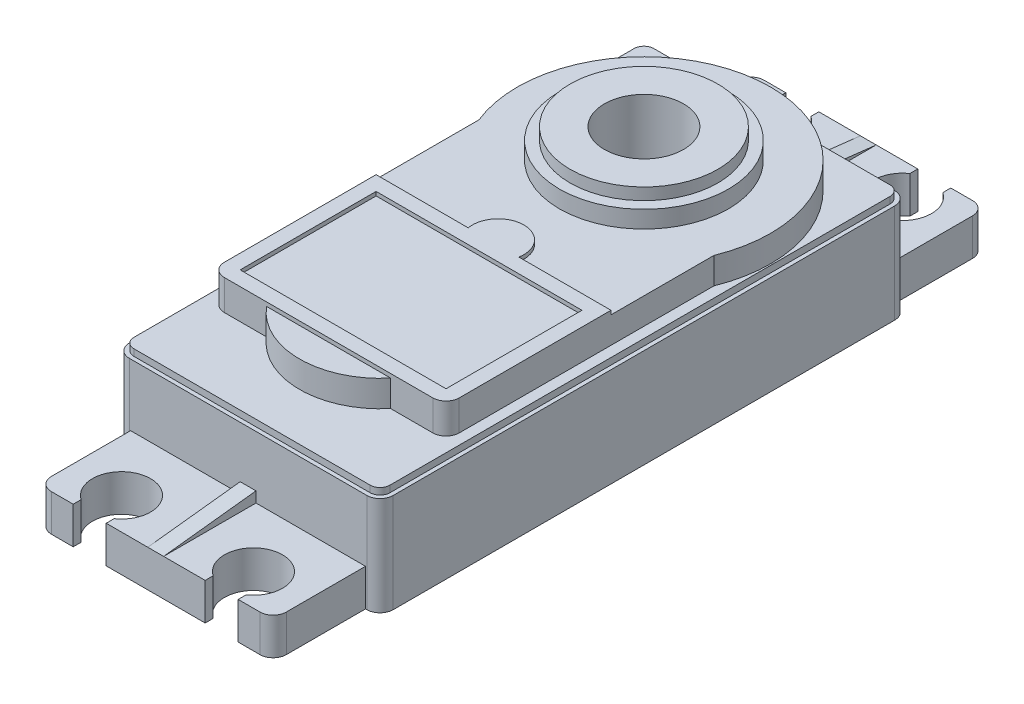
from build123d import *

# Parameters (mm, degrees)
SKETCH6_W            = 20
SKETCH6_H            = 40
BOSS_EXTRUDE3_DEPTH  = 8
CUT_EXTRUDE3_REACH   = 25.749
SKETCH11_R           = 3
SKETCH12_W           = 17.8
SKETCH12_H           = 2.8
BOSS_EXTRUDE4_DEPTH  = 7
CUT_EXTRUDE4_DEPTH   = 30.258161255
SKETCH20_R           = 0.7
CUT_EXTRUDE7_DEPTH   = 0.5
BOSS_EXTRUDE8_DEPTH  = 0.6
MIRROR7_COPY_1_DEPTH = 30.258161255
BOSS_EXTRUDE6_START  = 2
SKETCH16_R           = 3
BOSS_EXTRUDE6_DEPTH  = 2
BOSS_EXTRUDE9_DEPTH  = 2
BOSS_EXTRUDE10_START = 1.3
SKETCH24_R           = 6.4
SKETCH24_R_2         = 3
BOSS_EXTRUDE10_DEPTH = 1.3
BOSS_EXTRUDE11_START = 0.9
SKETCH25_R           = 5.6
SKETCH25_R_2         = 3
BOSS_EXTRUDE11_DEPTH = 0.9
SKETCH26_W           = 17.8
SKETCH26_H           = 12.5
SKETCH26_W_2         = 15.6
SKETCH26_H_2         = 10.3
BOSS_EXTRUDE12_DEPTH = 0.3
BOSS_EXTRUDE13_DEPTH = 0.3
SKETCH28_W           = 20
SKETCH28_H           = 40
SKETCH28_W_2         = 19.4
SKETCH28_H_2         = 39.4
CUT_EXTRUDE8_DEPTH   = 0.5
FILLET1_R            = 1
FILLET2_R            = 0.75


with BuildPart() as part:
    # Sketch6 → Boss-Extrude3 (new body)
    with BuildSketch(Plane(origin=(0, 0, 0), x_dir=(1, 0, 0), z_dir=(0, 1, 0))):
        Rectangle(SKETCH6_W, SKETCH6_H)
    extrude(amount=BOSS_EXTRUDE3_DEPTH)

    # Sketch11 → Cut-Extrude3 (cut, up to next)
    with BuildSketch(Plane(origin=(0, 8, 0), x_dir=(1, 0, 0), z_dir=(0, 1, 0)), mode=Mode.PRIVATE) as cut_extrude3_sk1:
        with Locations(Location((0, 10, 0), (0, 0, 270))):
            Circle(SKETCH11_R)
    cut_extrude3_tool1 = extrude(cut_extrude3_sk1.sketch, amount=-CUT_EXTRUDE3_REACH, mode=Mode.PRIVATE) & part.part
    add(cut_extrude3_tool1.solids().sort_by_distance((0, 8, -10))[0], mode=Mode.SUBTRACT)

    # Sketch12 → Boss-Extrude4 (add)
    with BuildSketch(Plane.XY.offset(20)):
        with Locations((0, 1.4)):
            Rectangle(SKETCH12_W, SKETCH12_H)
    boss_extrude4 = extrude(amount=BOSS_EXTRUDE4_DEPTH)

    # Sketch13 → Cut-Extrude4 (cut, through all)
    with BuildSketch(Plane(origin=(0, 2.8, 0), x_dir=(1, 0, 0), z_dir=(0, 1, 0))):
        with BuildLine():
            Line((-6.25, -26.4), (-6.25, -27))
            Line((-6.25, -27), (-3.75, -27))
            Line((-3.75, -27), (-3.75, -26.4))
            ThreePointArc((-3.75, -26.4), (-5, -22.389613301), (-6.25, -26.4))
        make_face()
    cut_extrude4 = extrude(amount=-CUT_EXTRUDE4_DEPTH, mode=Mode.SUBTRACT)

    # Mirror6: Cut-Extrude4 across plane
    add(cut_extrude4.mirror(Plane(origin=(0, 0, 0), x_dir=(0, 0, 1), z_dir=(1, 0, 0))), mode=Mode.SUBTRACT)

    # Sketch20 → Cut-Extrude7 (cut)
    with BuildSketch(Plane(origin=(0, 0, 0), x_dir=(-1, 0, 0), z_dir=(0, -1, 0))):
        with Locations(Location((0, -25, 0), (0, 0, 90))):
            Circle(SKETCH20_R)
    cut_extrude7 = extrude(amount=-CUT_EXTRUDE7_DEPTH, mode=Mode.SUBTRACT)

    # Sketch21 → Boss-Extrude8 (add, symmetric)
    with BuildSketch(Plane(origin=(0, 0, 0), x_dir=(0, 0, -1), z_dir=(1, 0, 0))):
        Polygon((-27, 2.8), (-20, 3.6), (-20, 2.8), align=None)
    boss_extrude8 = extrude(amount=BOSS_EXTRUDE8_DEPTH, both=True)

    # Mirror7: Boss-Extrude4, Cut-Extrude4, Cut-Extrude7, Boss-Extrude8 across plane
    add(boss_extrude4.mirror(Plane.XY))
    add(cut_extrude4.mirror(Plane.XY), mode=Mode.SUBTRACT)
    add(cut_extrude7.mirror(Plane.XY), mode=Mode.SUBTRACT)
    add(boss_extrude8.mirror(Plane.XY))

    # Mirror7 copy 1 sketch → Mirror7 copy 1 (cut, through all)
    with BuildSketch(Plane(origin=(0, 2.8, 0), x_dir=(-1, 0, 0), z_dir=(0, 1, 0))):
        with BuildLine():
            Line((-6.25, -26.4), (-6.25, -27))
            Line((-6.25, -27), (-3.75, -27))
            Line((-3.75, -27), (-3.75, -26.4))
            ThreePointArc((-3.75, -26.4), (-5, -22.389613301), (-6.25, -26.4))
        make_face()
    extrude(amount=-MIRROR7_COPY_1_DEPTH, mode=Mode.SUBTRACT)

    # Sketch16 → Boss-Extrude6 (add)
    with BuildSketch(Plane(origin=(0, 8, 0), x_dir=(1, 0, 0), z_dir=(0, 1, 0)).offset(BOSS_EXTRUDE6_START)):
        with BuildLine():
            Line((-8.9, -13.898610843), (8.9, -13.898610843))
            Line((8.9, -13.898610843), (8.9, 6.401389157))
            ThreePointArc((8.9, 6.401389157), (0, 19.6), (-8.9, 6.401389157))
            Line((-8.9, 6.401389157), (-8.9, -13.898610843))
        make_face()
        with Locations(Location((0, 10, 0), (0, 0, 270))):
            Circle(SKETCH16_R, mode=Mode.SUBTRACT)
    extrude(amount=-BOSS_EXTRUDE6_DEPTH)

    # Sketch23 → Boss-Extrude9 (add)
    with BuildSketch(Plane(origin=(0, 8, 0), x_dir=(1, 0, 0), z_dir=(0, 1, 0))):
        with BuildLine():
            Line((-4.7, -13.898610843), (4.7, -13.898610843))
            ThreePointArc((4.7, -13.898610843), (0, -16.098610843), (-4.7, -13.898610843))
        make_face()
    extrude(amount=BOSS_EXTRUDE9_DEPTH)

    # Sketch24 → Boss-Extrude10 (add)
    with BuildSketch(Plane(origin=(0, 10, 0), x_dir=(1, 0, 0), z_dir=(0, 1, 0)).offset(BOSS_EXTRUDE10_START)):
        with Locations(Location((0, 10, 0), (0, 0, 270))):
            Circle(SKETCH24_R)
        with Locations(Location((0, 10, 0), (0, 0, 270))):
            Circle(SKETCH24_R_2, mode=Mode.SUBTRACT)
    extrude(amount=-BOSS_EXTRUDE10_DEPTH)

    # Sketch25 → Boss-Extrude11 (add)
    with BuildSketch(Plane(origin=(0, 11.3, 0), x_dir=(1, 0, 0), z_dir=(0, 1, 0)).offset(BOSS_EXTRUDE11_START)):
        with Locations(Location((0, 10, 0), (0, 0, 270))):
            Circle(SKETCH25_R)
        with Locations(Location((0, 10, 0), (0, 0, 270))):
            Circle(SKETCH25_R_2, mode=Mode.SUBTRACT)
    extrude(amount=-BOSS_EXTRUDE11_DEPTH)

    # Sketch26 → Boss-Extrude12 (add)
    with BuildSketch(Plane(origin=(0, 10, 0), x_dir=(1, 0, 0), z_dir=(0, 1, 0))):
        with Locations((0, -7.648610843)):
            Rectangle(SKETCH26_W, SKETCH26_H)
        with Locations((0, -7.648610843)):
            Rectangle(SKETCH26_W_2, SKETCH26_H_2, mode=Mode.SUBTRACT)
    extrude(amount=BOSS_EXTRUDE12_DEPTH)

    # Sketch27 → Boss-Extrude13 (add)
    with BuildSketch(Plane(origin=(0, 10, 0), x_dir=(1, 0, 0), z_dir=(0, 1, 0))):
        with BuildLine():
            Line((1.303840481, -2.498610843), (-1.303840481, -2.498610843))
            ThreePointArc((-1.303840481, -2.498610843), (0, 0.901389157), (1.303840481, -2.498610843))
        make_face()
    extrude(amount=BOSS_EXTRUDE13_DEPTH)

    # Sketch28 → Cut-Extrude8 (cut)
    with BuildSketch(Plane(origin=(0, 8, 0), x_dir=(1, 0, 0), z_dir=(0, 1, 0))):
        Rectangle(SKETCH28_W, SKETCH28_H)
        Rectangle(SKETCH28_W_2, SKETCH28_H_2, mode=Mode.SUBTRACT)
    extrude(amount=-CUT_EXTRUDE8_DEPTH, mode=Mode.SUBTRACT)

    # Fillet1
    fillet1_edges = [part.edges().sort_by_distance(p)[0] for p in [
        (-10, 3.75, -20),
        (10, 3.75, -20),
        (10, 3.75, 20),
        (-10, 3.75, 20),
        (-8.9, 9.15, 13.898610843),
        (8.9, 9.15, 13.898610843),
        (-8.9, 1.4, -27),
        (8.9, 1.4, -27),
        (8.9, 1.4, 27),
        (-8.9, 1.4, 27),
    ]]
    fillet(fillet1_edges, radius=FILLET1_R)

    # Fillet2
    fillet2_edges = [part.edges().sort_by_distance(p)[0] for p in [
        (9.7, 7.75, -19.7),
        (9.7, 7.75, 19.7),
        (-9.7, 7.75, 19.7),
        (-9.7, 7.75, -19.7),
    ]]
    fillet(fillet2_edges, radius=FILLET2_R)


solid = part.part
